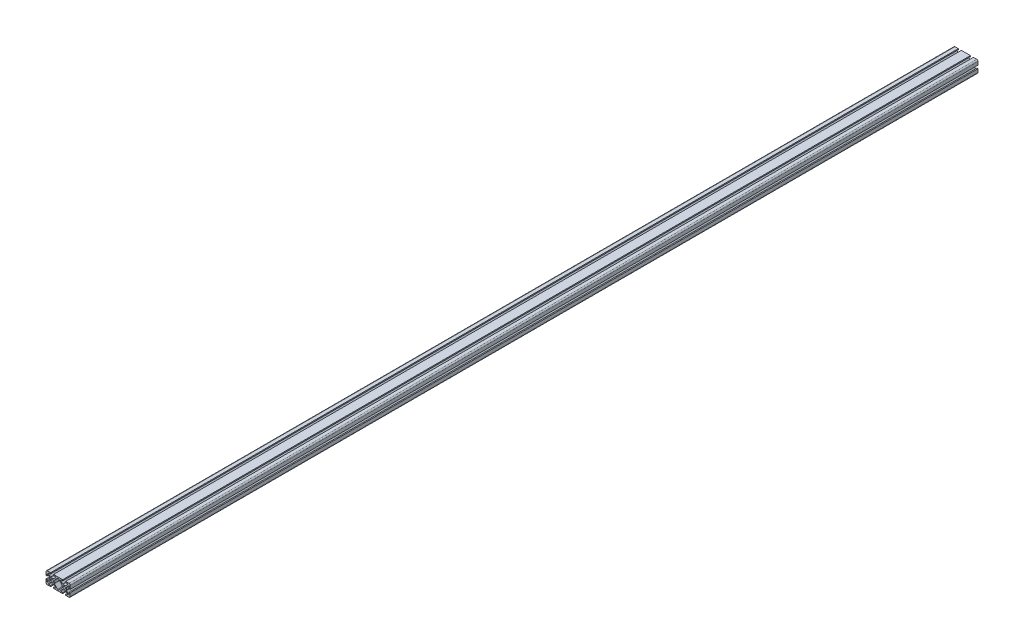
from build123d import *

# Parameters (mm, degrees)
BOSS_EXTRUDE1_DEPTH = 1524
BOSS_EXTRUDE2_DEPTH = 1524
FILLET1_R           = 0.75
FILLET2_R           = 1.25
SKETCH5_W           = 1548
SKETCH5_H           = 20
CUT_EXTRUDE1_DEPTH  = 1525.55764076


with BuildPart() as part:
    # Sketch3 → Boss-Extrude1 (new, symmetric)
    with BuildSketch(Plane.XY):
        with BuildLine():
            Line((12.5, -10), (17.9, -10))
            ThreePointArc((17.9, -10), (19.38492424, -9.38492424), (20, -7.9))
            Line((20, -7.9), (20, -2.5))
            Line((20, -2.5), (18.213351365, -2.5))
            Line((18.213351365, -2.5), (18.213351365, -6.95))
            Line((18.213351365, -6.95), (13.6, -2.336648635))
            Line((13.6, -2.336648635), (13.6, 0))
            Line((13.6, 0), (12.15, 0))
            ThreePointArc((12.15, 0), (11.52027958, -1.52027958), (10, -2.15))
            Line((10, -2.15), (10, -3.6))
            Line((10, -3.6), (12.336648635, -3.6))
            Line((12.336648635, -3.6), (16.95, -8.213351365))
            Line((16.95, -8.213351365), (12.5, -8.213351365))
            Line((12.5, -8.213351365), (12.5, -10))
        make_face()
    extrude(amount=BOSS_EXTRUDE1_DEPTH, both=True)

    # Sketch4 → Boss-Extrude2 (add, symmetric)
    with BuildSketch(Plane.XY):
        with BuildLine():
            Line((10, -3.6), (7.663351365, -3.6))
            Line((7.663351365, -3.6), (3.05, -8.213351365))
            Line((3.05, -8.213351365), (7.5, -8.213351365))
            Line((7.5, -8.213351365), (7.5, -10))
            Line((7.5, -10), (0, -10))
            Line((0, -10), (0, -8.736648635))
            Line((0, -8.736648635), (6.4, -2.336648635))
            Line((6.4, -2.336648635), (6.4, 0))
            Line((6.4, 0), (7.85, 0))
            ThreePointArc((7.85, 0), (8.47972042, -1.52027958), (10, -2.15))
            Line((10, -2.15), (10, -3.6))
        make_face()
    extrude(amount=BOSS_EXTRUDE2_DEPTH, both=True)

    # Mirror1: part across plane


with BuildPart() as part_1:
    add(part.part)
    add(part.part.mirror(Plane(origin=(0, 0, 0), x_dir=(0, 0, 1), z_dir=(1, 0, 0))))

    # Mirror2: part across plane


with BuildPart() as part_2:
    add(part_1.part)
    add(part_1.part.mirror(Plane.ZX))

    # Fillet1
    fillet1_edges = [part_2.edges().sort_by_distance(p)[0] for p in [
        (18.213351365, 6.95, 0),
        (13.6, 2.336648635, 0),
        (12.336648635, 3.6, 0),
        (16.95, 8.213351365, 0),
        (3.05, 8.213351365, 0),
        (7.663351365, 3.6, 0),
        (-18.213351365, 6.95, 0),
        (-13.6, 2.336648635, 0),
        (-7.663351365, 3.6, 0),
        (-12.336648635, 3.6, 0),
        (-16.95, 8.213351365, 0),
        (-3.05, 8.213351365, 0),
        (16.95, -8.213351365, 0),
        (12.336648635, -3.6, 0),
        (13.6, -2.336648635, 0),
        (18.213351365, -6.95, 0),
        (3.05, -8.213351365, 0),
        (7.663351365, -3.6, 0),
        (-18.213351365, -6.95, 0),
        (-13.6, -2.336648635, 0),
        (-12.336648635, -3.6, 0),
        (-16.95, -8.213351365, 0),
        (-3.05, -8.213351365, 0),
        (-7.663351365, -3.6, 0),
    ]]
    fillet(fillet1_edges, radius=FILLET1_R)

    # Fillet2
    fillet2_edges = [part_2.edges().sort_by_distance(p)[0] for p in [
        (6.4, 2.336648635, 0),
        (0, 8.736648635, 0),
        (-6.4, 2.336648635, 0),
        (6.4, -2.336648635, 0),
        (-6.4, -2.336648635, 0),
        (0, -8.736648635, 0),
    ]]
    fillet(fillet2_edges, radius=FILLET2_R)

    # Sketch5 → Cut-Extrude1 (cut, through all)
    with BuildSketch(Plane.ZY.offset(20)):
        with Locations((750, 0)):
            Rectangle(SKETCH5_W, SKETCH5_H)
    extrude(amount=-CUT_EXTRUDE1_DEPTH, mode=Mode.SUBTRACT)


solid = part_2.part
